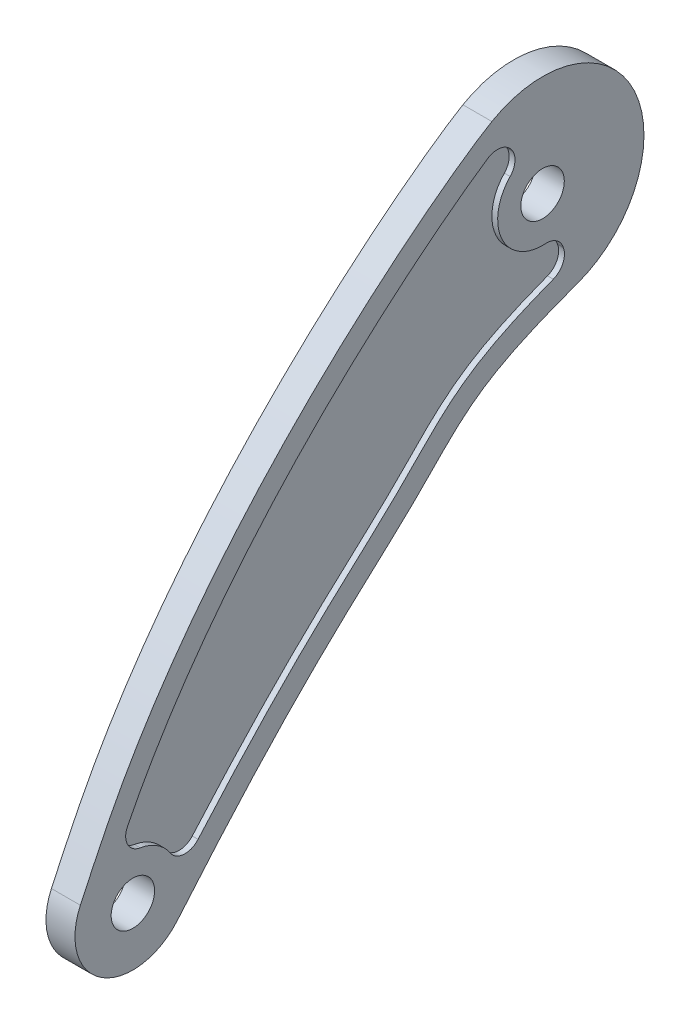
from build123d import *

# Parameters (mm, degrees)
BOSS_EXTRUDE1_DEPTH     = 10
CUT_EXTRUDE1_DEPTH      = 229.503191587
CUT_EXTRUDE1_DEPTH_BACK = 229.503191587
SKETCH2_R               = 7.5
CUT_EXTRUDE4_DEPTH      = 2
FILLET3_R               = 6


with BuildPart() as part:
    # Sketch1 → Boss-Extrude1 (new body)
    with BuildSketch(Plane(origin=(0, 0, 0), x_dir=(0, 0, -1), z_dir=(1, 0, 0))):
        with BuildLine():
            ThreePointArc((11.970705016, -32.889241728), (31.720772546, 14.791639161), (-17.5, 30.310889132))
            add(Edge.make_bspline(
                [(-17.5, 30.310889132), (-34.321955695, 20.598728483), (-116.723953626, -40.410250972), (-156.313763477, -126.034194964), (-159.547511978, -132.968991002)],
                knots=[0, 0, 0, 0, 0.889912334, 1, 1, 1, 1], degree=3))
            ThreePointArc((-159.547511978, -132.968991002), (-152.167348404, -158.289185154), (-126.100467375, -154.277108431))
            add(Edge.make_bspline(
                [(-126.100467375, -154.277108431), (-80.64177253, -100.101545535), (-58.2293325, -84.719492888), (-25.919121569, -50.790307967), (-14.885033301, -42.663931094), (11.970705016, -32.889241728)],
                knots=[0, 0, 0, 0, 0.511217005, 0.600270542, 0.89053537, 0.89053537, 0.89053537, 0.89053537], degree=3))
        make_face()
    extrude(amount=BOSS_EXTRUDE1_DEPTH)

    # Sketch2 → Cut-Extrude1 (cut, two sides: drawn at the far end of the back side and taken through both)
    with BuildSketch(Plane(origin=(10, 0, 0), x_dir=(0, 0, -1), z_dir=(1, 0, 0)).offset(-CUT_EXTRUDE1_DEPTH_BACK)):
        Circle(SKETCH2_R)
        with Locations((-141.421356237, -141.421356237)):
            Circle(SKETCH2_R)
    extrude(amount=CUT_EXTRUDE1_DEPTH + CUT_EXTRUDE1_DEPTH_BACK, mode=Mode.SUBTRACT)

    # Sketch8 → Cut-Extrude4 (cut)
    with BuildSketch(Plane(origin=(10, 0, 0), x_dir=(0, 0, -1), z_dir=(1, 0, 0))):
        with BuildLine():
            ThreePointArc((5.301312222, -14.565235622), (-14.047770699, -6.550583057), (-7.75, 13.423393759))
            Line((-7.75, 13.423393759), (-13.270700045, 22.985526729))
            Line((-13.270700045, 22.985526729), (-13.5, 23.382685902))
            add(Edge.make_bspline(
                [(-13.5, 23.382685902), (-14.004264792, 23.091548489), (-14.596989898, 22.736556542), (-15.930761723, 21.910191472), (-16.672259928, 21.43865672), (-19.096143962, 19.858481722), (-20.97746579, 18.58453004), (-23.985838626, 16.468739554), (-24.932203297, 15.79405814), (-25.916949038, 15.082203502)],
                knots=[0, 0, 0, 0, 0.03125, 0.03125, 0.0625, 0.0625, 0.125, 0.125, 0.151902129, 0.151902129, 0.151902129, 0.151902129], degree=3))
            add(Edge.make_bspline(
                [(-25.916949038, 15.082203502), (-29.507797216, 12.4864452), (-33.608989313, 9.396403406), (-49.503275079, -3.177533176), (-63.377476055, -15.156595083), (-91.964800189, -43.803959857), (-106.678912673, -60.475554794), (-126.373284326, -88.065760368), (-132.542324418, -97.692221413), (-138.762340902, -108.912812223), (-139.443275699, -110.164633361), (-140.784992316, -112.680202379), (-141.44751941, -113.947019213), (-143.40368157, -117.749366226), (-144.665797353, -120.286656297), (-146.645761611, -124.353749783), (-147.397332853, -125.92044903), (-148.121316458, -127.444213001)],
                knots=[0.151902129, 0.151902129, 0.151902129, 0.151902129, 0.25, 0.25, 0.5, 0.5, 0.75, 0.75, 0.875, 0.875, 0.890625, 0.890625, 0.90625, 0.90625, 0.9375, 0.9375, 0.957617953, 0.957617953, 0.957617953, 0.957617953], degree=3))
            ThreePointArc((-148.121316458, -127.444213001), (-133.163008443, -128.304584847), (-125.921356237, -141.421356237))
            ThreePointArc((-125.921356237, -141.421356237), (-125.921911553, -141.552560245), (-125.923577462, -141.683754851))
            add(Edge.make_bspline(
                [(-125.923577462, -141.683754851), (-118.529925562, -133.022812133), (-111.861983926, -125.488119901), (-98.042519438, -110.377224048), (-91.266586508, -103.365591459), (-79.155605263, -91.336141526), (-73.820810692, -86.318727269), (-66.552703556, -79.612530547), (-64.252740209, -77.514005309), (-59.839444304, -73.477424972), (-57.726273613, -71.539479143), (-53.620860933, -67.706762992), (-51.628593649, -65.812039684), (-49.166594827, -63.393004096), (-48.676627606, -62.907593959), (-47.692724643, -61.92458048), (-47.198430387, -61.426856534), (-45.710588093, -59.921105575), (-44.712177008, -58.90055567), (-42.710952583, -56.857105325), (-41.708160185, -55.834215393), (-39.703469442, -53.815256413), (-38.703400895, -52.821019854), (-35.691473525, -49.90421685), (-33.653791845, -48.033660498), (-29.262128181, -44.400093328), (-26.909957963, -42.640832773), (-21.694579862, -39.210652351), (-18.834074142, -37.540197568), (-12.384697646, -34.20169183), (-8.795186024, -32.532039364), (-0.610596797, -29.072552339), (3.985554691, -27.282176582), (9.23454387, -25.371700761)],
                knots=[0.027086016, 0.027086016, 0.027086016, 0.027086016, 0.125, 0.125, 0.25, 0.25, 0.375, 0.375, 0.4375, 0.4375, 0.5, 0.5, 0.5625, 0.5625, 0.578125, 0.578125, 0.59375, 0.59375, 0.625, 0.625, 0.65625, 0.65625, 0.6875, 0.6875, 0.75, 0.75, 0.8125, 0.8125, 0.875, 0.875, 0.9375, 0.9375, 1, 1, 1, 1], degree=3))
            Line((9.23454387, -25.371700761), (5.301312222, -14.565235622))
        make_face()
    cut_extrude4 = extrude(amount=-CUT_EXTRUDE4_DEPTH, mode=Mode.SUBTRACT)

    # Fillet3
    fillet3_edges = [part.edges().sort_by_distance(p)[0] for p in [
        (9, -25.371700761, -9.23454387),
        (9, -14.565235622, -5.301312222),
        (9, 13.423393759, 7.75),
        (9, 23.382685902, 13.5),
        (9, -141.683754851, 125.923577462),
        (9, -127.444213001, 148.121316458),
    ]]
    fillet(fillet3_edges, radius=FILLET3_R)

    # Mirror1: Cut-Extrude4 across plane
    add(cut_extrude4.mirror(Plane(origin=(5, 0, 0), x_dir=(0, 0, 1), z_dir=(1, 0, 0))), mode=Mode.SUBTRACT)


solid = part.part
